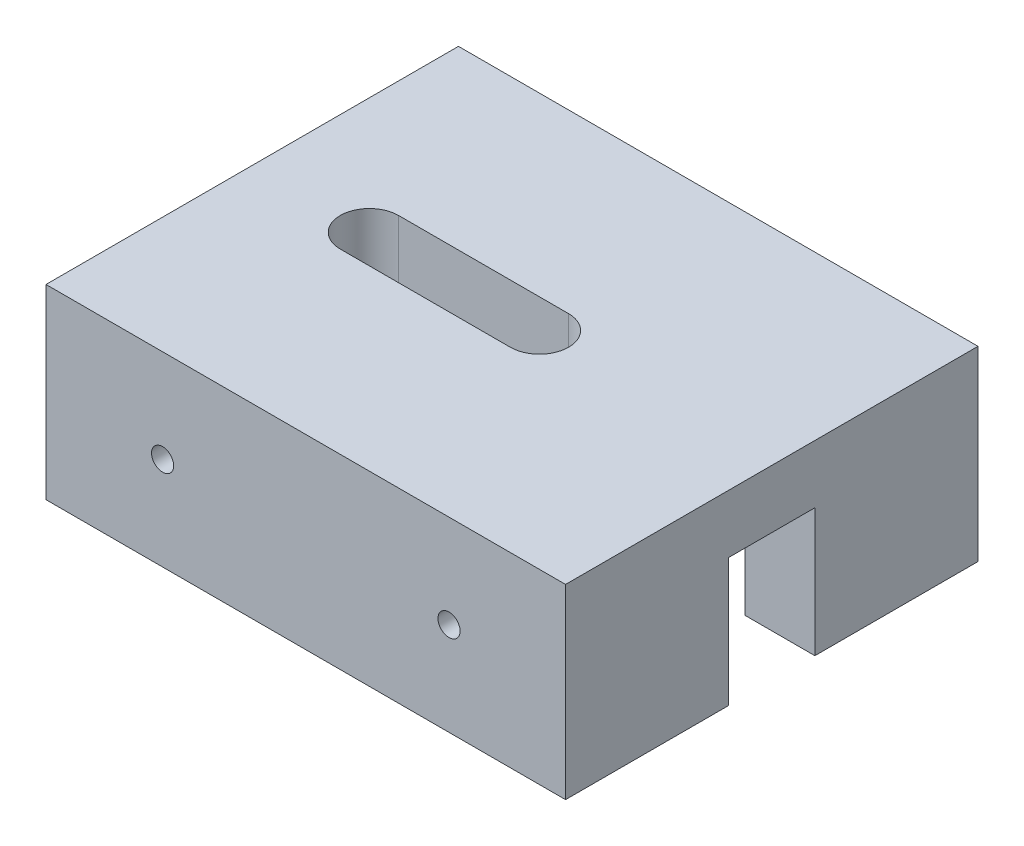
from build123d import *

# Parameters (mm, degrees)
SKETCH2_W                    = 22.296412808
SKETCH2_H                    = 8
BOSS_EXTRUDE1_DEPTH          = 17.7
CUT_EXTRUDE2_DEPTH           = 5.5
CUT_EXTRUDE3_REACH           = 30.994
SKETCH9_R                    = 1.5
CUT_EXTRUDE4_DEPTH           = 2
M1_2X0_25_TAPPED_HOLE2_D     = 0.95
M1_2X0_25_TAPPED_HOLE2_DEPTH = 2
M1_2X0_25_TAPPED_HOLE2_TIP   = 0.285408794


with BuildPart() as part:
    # Sketch2 → Boss-Extrude1 (new body)
    with BuildSketch(Plane.XY):
        with Locations((11.148206404, 4)):
            Rectangle(SKETCH2_W, SKETCH2_H)
    extrude(amount=BOSS_EXTRUDE1_DEPTH)

    # Sketch3 → Cut-Extrude2 (cut)
    with BuildSketch(Plane.XZ):
        Polygon((0, 15.2), (19.296412808, 15.2), (19.296412808, 10.7), (22.296412808, 10.7), (22.296412808, 7), (19.296412808, 7), (19.296412808, 2.5), (0, 2.5), align=None)
    extrude(amount=-CUT_EXTRUDE2_DEPTH, mode=Mode.SUBTRACT)

    # Sketch4 → Cut-Extrude3 (cut, up to next)
    with BuildSketch(Plane.XZ.offset(-5.5), mode=Mode.PRIVATE) as cut_extrude3_sk1:
        with BuildLine():
            Line((5, 10.070818057), (12.296412808, 10.070818057))
            ThreePointArc((12.296412808, 10.070818057), (13.546412808, 8.820818057), (12.296412808, 7.570818057))
            Line((12.296412808, 7.570818057), (5, 7.570818057))
            ThreePointArc((5, 7.570818057), (3.75, 8.820818057), (5, 10.070818057))
        make_face()
    cut_extrude3_tool1 = extrude(cut_extrude3_sk1.sketch, amount=-CUT_EXTRUDE3_REACH, mode=Mode.PRIVATE) & part.part
    add(cut_extrude3_tool1.solids().sort_by_distance((8.648206, 5.5, 8.820818))[0], mode=Mode.SUBTRACT)

    # Sketch9 → Cut-Extrude4 (cut)
    with BuildSketch(Plane.ZY.offset(-19.296412808)):
        with Locations((4.75, 2.75)):
            Circle(SKETCH9_R)
        with Locations((12.95, 2.75)):
            Circle(SKETCH9_R)
    extrude(amount=-CUT_EXTRUDE4_DEPTH, mode=Mode.SUBTRACT)

    # M1.2x0.25 Tapped Hole2
    with Locations(Plane(origin=(17.296412808, 4, 17.7), x_dir=(1, 0, 0), z_dir=(0, 0, 1))):
        with Locations((0, 0), (-12.293258023, 0)):
            Hole(M1_2X0_25_TAPPED_HOLE2_D / 2, depth=M1_2X0_25_TAPPED_HOLE2_DEPTH)
            with Locations((0, 0, -(M1_2X0_25_TAPPED_HOLE2_DEPTH + M1_2X0_25_TAPPED_HOLE2_TIP / 2))):  # 118° drill point
                Cone(0, M1_2X0_25_TAPPED_HOLE2_D / 2, M1_2X0_25_TAPPED_HOLE2_TIP, mode=Mode.SUBTRACT)


solid = part.part
